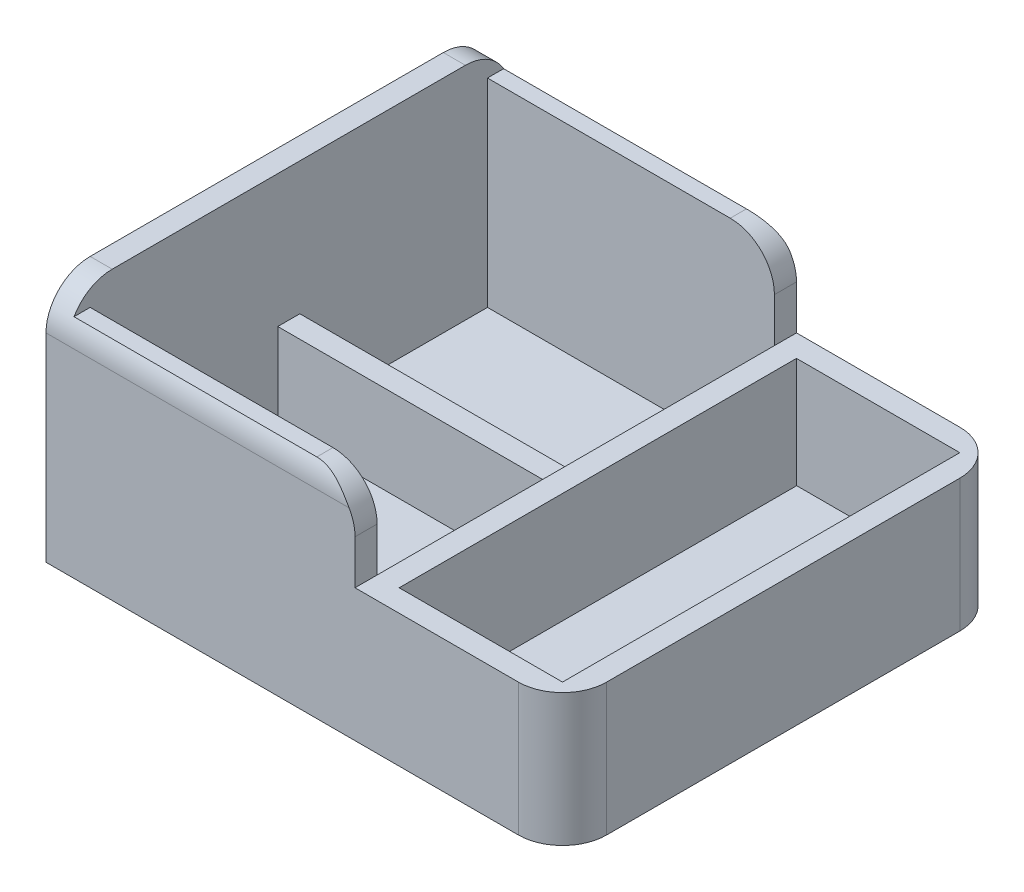
from build123d import *

# Parameters (mm, degrees)
CROQUIS1_W                   = 70
CROQUIS1_H                   = 100
SALIENTE_EXTRUIR2_DEPTH      = 5
CROQUIS2_W                   = 5
CROQUIS2_H                   = 100
SALIENTE_EXTRUIR3_DEPTH      = 50
CROQUIS3_W                   = 65
CROQUIS3_H                   = 5
SALIENTE_EXTRUIR4_DEPTH      = 45
CROQUIS4_W                   = 65
CROQUIS4_H                   = 5
SALIENTE_EXTRUIR5_DEPTH      = 45
CROQUIS5_W                   = 5
CROQUIS5_H                   = 100
SALIENTE_EXTRUIR6_DEPTH      = 30
REDONDEO2_R                  = 10
REDONDEO3_R                  = 10
REDONDEO4_R                  = 10
REDONDEO5_R                  = 10
SALIENTE_EXTRUIR8_DEPTH      = 2.5
SALIENTE_EXTRUIR8_DEPTH_BACK = 2.5
CROQUIS10_W                  = 65
CROQUIS10_H                  = 20
SALIENTE_EXTRUIR9_DEPTH      = 37
CROQUIS12_W                  = 5
CROQUIS12_H                  = 100
SALIENTE_EXTRUIR10_DEPTH     = 30
REDONDEO10_R                 = 10
REDONDEO11_R                 = 10
REDONDEO13_R                 = 10
REDONDEO16_R                 = 10


with BuildPart() as part:
    # Croquis1 → Saliente-Extruir2 (new body)
    with BuildSketch(Plane(origin=(0, 0, 0), x_dir=(1, 0, 0), z_dir=(0, 1, 0))):
        Rectangle(CROQUIS1_W, CROQUIS1_H)
    extrude(amount=SALIENTE_EXTRUIR2_DEPTH)

    # Croquis2 → Saliente-Extruir3 (add)
    with BuildSketch(Plane(origin=(0, 5, 0), x_dir=(1, 0, 0), z_dir=(0, 1, 0))):
        with Locations((-32.5, 0)):
            Rectangle(CROQUIS2_W, CROQUIS2_H)
    extrude(amount=SALIENTE_EXTRUIR3_DEPTH)

    # Croquis3 → Saliente-Extruir4 (add)
    with BuildSketch(Plane(origin=(0, 5, 0), x_dir=(1, 0, 0), z_dir=(0, 1, 0))):
        with Locations((2.5, -47.5)):
            Rectangle(CROQUIS3_W, CROQUIS3_H)
    extrude(amount=SALIENTE_EXTRUIR4_DEPTH)

    # Croquis4 → Saliente-Extruir5 (add)
    with BuildSketch(Plane(origin=(0, 5, 0), x_dir=(1, 0, 0), z_dir=(0, 1, 0))):
        with Locations((2.5, 47.5)):
            Rectangle(CROQUIS4_W, CROQUIS4_H)
    extrude(amount=SALIENTE_EXTRUIR5_DEPTH)

    # Croquis5 → Saliente-Extruir6 (add)
    with BuildSketch(Plane.XZ):
        with Locations((37.5, 0)):
            Rectangle(CROQUIS5_W, CROQUIS5_H)
    extrude(amount=-SALIENTE_EXTRUIR6_DEPTH)

    # Redondeo2
    redondeo2_edges = [part.edges().sort_by_distance(p)[0] for p in [
        (35, 50, 47.5),
    ]]
    fillet(redondeo2_edges, radius=REDONDEO2_R)

    # Redondeo3
    redondeo3_edges = [part.edges().sort_by_distance(p)[0] for p in [
        (35, 50, -47.5),
    ]]
    fillet(redondeo3_edges, radius=REDONDEO3_R)

    # Redondeo4
    redondeo4_edges = [part.edges().sort_by_distance(p)[0] for p in [
        (-32.5, 55, 50),
    ]]
    fillet(redondeo4_edges, radius=REDONDEO4_R)

    # Redondeo5
    redondeo5_edges = [part.edges().sort_by_distance(p)[0] for p in [
        (-32.5, 55, -50),
    ]]
    fillet(redondeo5_edges, radius=REDONDEO5_R)

    # Croquis10 → Saliente-Extruir8 (add, two sides: drawn at the far end of the back side and taken through both)
    with BuildSketch(Plane.XY.offset(-SALIENTE_EXTRUIR8_DEPTH_BACK)):
        with Locations((2.5, 15)):
            Rectangle(CROQUIS10_W, CROQUIS10_H)
    extrude(amount=SALIENTE_EXTRUIR8_DEPTH + SALIENTE_EXTRUIR8_DEPTH_BACK)

    # Croquis11 → Saliente-Extruir9 (add)
    with BuildSketch(Plane(origin=(40, 0, 0), x_dir=(0, 0, -1), z_dir=(1, 0, 0))):
        Polygon((-50, 30), (-45, 30), (-45, 5), (45.044544461, 5), (45, 30), (50, 30), (50, 0), (-50, 0), align=None)
    extrude(amount=SALIENTE_EXTRUIR9_DEPTH)

    # Croquis12 → Saliente-Extruir10 (add)
    with BuildSketch(Plane.XZ):
        with Locations((79.5, 0)):
            Rectangle(CROQUIS12_W, CROQUIS12_H)
    extrude(amount=-SALIENTE_EXTRUIR10_DEPTH)

    # Redondeo10
    redondeo10_edges = [part.edges().sort_by_distance(p)[0] for p in [
        (77, 5, -0.022272231),
    ]]
    fillet(redondeo10_edges, radius=REDONDEO10_R)

    # Redondeo11
    redondeo11_edges = [part.edges().sort_by_distance(p)[0] for p in [
        (82, 15, -50),
    ]]
    fillet(redondeo11_edges, radius=REDONDEO11_R)

    # Redondeo13
    redondeo13_edges = [part.edges().sort_by_distance(p)[0] for p in [
        (82, 15, 50),
    ]]
    fillet(redondeo13_edges, radius=REDONDEO13_R)

    # Redondeo16
    redondeo16_edges = [part.edges().sort_by_distance(p)[0] for p in [
        (35, 5, -23.75),
        (35, 5, 23.75),
    ]]
    fillet(redondeo16_edges, radius=REDONDEO16_R)


solid = part.part
